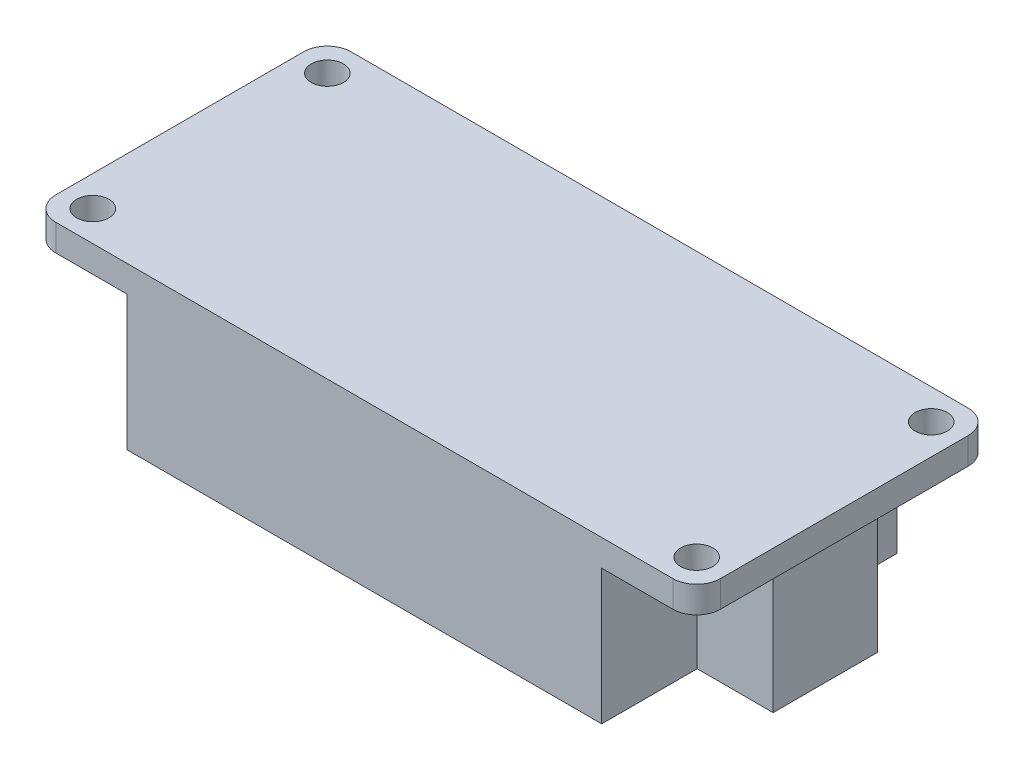
from build123d import *

# Parameters (mm, degrees)
BOSS_EXTRUDE1_DEPTH = 14.2
BOSS_EXTRUDE2_DEPTH = 2.8
SKETCH3_R           = 1.7
CUT_EXTRUDE2_DEPTH  = 70.686512325


with BuildPart() as part:
    # Sketch1 → Boss-Extrude1 (new body)
    with BuildSketch(Plane(origin=(0, 0, 0), x_dir=(1, 0, 0), z_dir=(0, 1, 0))):
        Polygon((0, 21.05), (0, 31.1), (50, 31.1), (50, 21.05), (58, 21.05), (58, 10.05), (50, 10.05), (50, 0), (0, 0), (0, 10.05), (-8, 10.05), (-8, 21.05), align=None)
    extrude(amount=BOSS_EXTRUDE1_DEPTH)

    # Sketch2 → Boss-Extrude2 (add)
    with BuildSketch(Plane(origin=(0, 14.2, 0), x_dir=(1, 0, 0), z_dir=(0, 1, 0))):
        with BuildLine():
            Line((57.5, 31.1), (-7.5, 31.1))
            ThreePointArc((-7.5, 31.1), (-9.267766953, 30.367766953), (-10, 28.6))
            Line((-10, 28.6), (-10, 2.5))
            ThreePointArc((-10, 2.5), (-9.267766953, 0.732233047), (-7.5, 0))
            Line((-7.5, 0), (57.5, 0))
            ThreePointArc((57.5, 0), (59.267766953, 0.732233047), (60, 2.5))
            Line((60, 2.5), (60, 28.6))
            ThreePointArc((60, 28.6), (59.267766953, 30.367766953), (57.5, 31.1))
        make_face()
    extrude(amount=BOSS_EXTRUDE2_DEPTH)

    # Sketch3 → Cut-Extrude2 (cut, through all)
    with BuildSketch(Plane(origin=(0, 17, 0), x_dir=(1, 0, 0), z_dir=(0, 1, 0))):
        with Locations(Location((-6.8, 3.2, 0), (0, 0, 270))):
            Circle(SKETCH3_R)
        with Locations(Location((56.8, 3.2, 0), (0, 0, 270))):
            Circle(SKETCH3_R)
        with Locations(Location((56.8, 27.9, 0), (0, 0, 270))):
            Circle(SKETCH3_R)
        with Locations(Location((-6.8, 27.9, 0), (0, 0, 270))):
            Circle(SKETCH3_R)
    extrude(amount=-CUT_EXTRUDE2_DEPTH, mode=Mode.SUBTRACT)


solid = part.part
